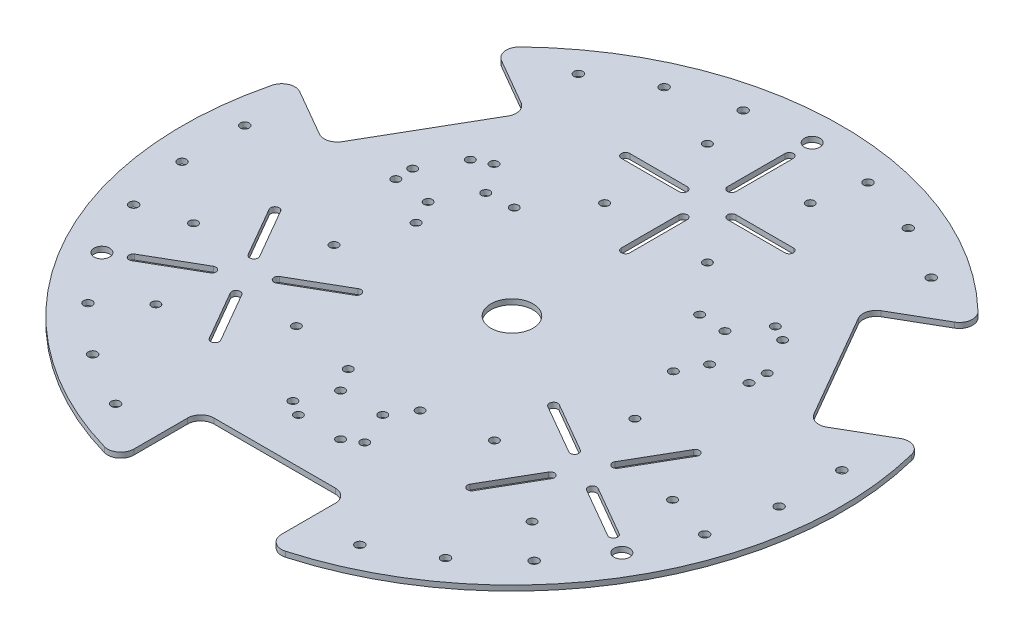
from build123d import *

# Parameters (mm, degrees)
SKETCH1_R           = 8
SKETCH1_R_2         = 2.95
SKETCH1_R_3         = 1.675
SKETCH1_R_4         = 1.6
BOSS_EXTRUDE2_DEPTH = 2
FILLET1_R           = 5


with BuildPart() as part:
    # Sketch1 → Boss-Extrude2 (new body)
    with BuildSketch(Plane(origin=(0, 0, 0), x_dir=(1, 0, 0), z_dir=(0, 1, 0))):
        with BuildLine():
            Line((-89.442286341, 25.081415713), (-66.442286341, 64.918584287))
            ThreePointArc((-66.442286341, 64.918584287), (-65.942784228, 68.712679513), (-68.27241336, 71.748711306))
            Line((-68.27241336, 71.748711306), (-91.502369642, 85.160532819))
            ThreePointArc((-91.502369642, 85.160532819), (0, 125), (91.502369642, 85.160532819))
            Line((91.502369642, 85.160532819), (68.27241336, 71.748711306))
            ThreePointArc((68.27241336, 71.748711306), (65.942784228, 68.712679513), (66.442286341, 64.918584287))
            Line((66.442286341, 64.918584287), (89.442286341, 25.081415713))
            ThreePointArc((89.442286341, 25.081415713), (92.478318134, 22.751786582), (96.27241336, 23.251288694))
            Line((96.27241336, 23.251288694), (119.502369642, 36.663110207))
            ThreePointArc((119.502369642, 36.663110207), (108.253175473, -62.5), (28, -121.823643025))
            Line((28, -121.823643025), (28, -95))
            ThreePointArc((28, -95), (26.535533906, -91.464466094), (23, -90))
            Line((23, -90), (-23, -90))
            ThreePointArc((-23, -90), (-26.535533906, -91.464466094), (-28, -95))
            Line((-28, -95), (-28, -121.823643025))
            ThreePointArc((-28, -121.823643025), (-108.253175473, -62.5), (-119.502369642, 36.663110207))
            Line((-119.502369642, 36.663110207), (-96.27241336, 23.251288694))
            ThreePointArc((-96.27241336, 23.251288694), (-92.478318134, 22.751786582), (-89.442286341, 25.081415713))
        make_face()
        with Locations(Location((0, 0, 0), (0, 0, 270))):
            Circle(SKETCH1_R, mode=Mode.SUBTRACT)
        with Locations(Location((0, 113.85, 0), (0, 0, 270))):
            Circle(SKETCH1_R_2, mode=Mode.SUBTRACT)
        with Locations(Location((98.596992221, -56.925, 0), (0, 0, 270))):
            Circle(SKETCH1_R_2, mode=Mode.SUBTRACT)
        with Locations(Location((-98.596992221, -56.925, 0), (0, 0, 270))):
            Circle(SKETCH1_R_2, mode=Mode.SUBTRACT)
        with Locations(Location((23.670746, 111.362104344, 0), (0, 0, 270))):
            Circle(SKETCH1_R_3, mode=Mode.SUBTRACT)
        with Locations(Location((46.306966814, 104.007150353, 0), (0, 0, 270))):
            Circle(SKETCH1_R_3, mode=Mode.SUBTRACT)
        with Locations(Location((66.919350973, 92.10658481, 0), (0, 0, 270))):
            Circle(SKETCH1_R_3, mode=Mode.SUBTRACT)
        with Locations(Location((113.226317788, 11.900565543, 0), (0, 0, 270))):
            Circle(SKETCH1_R_3, mode=Mode.SUBTRACT)
        with Locations(Location((113.226317788, -11.900565543, 0), (0, 0, 270))):
            Circle(SKETCH1_R_3, mode=Mode.SUBTRACT)
        with Locations(Location((108.27778438, -35.18158481, 0), (0, 0, 270))):
            Circle(SKETCH1_R_3, mode=Mode.SUBTRACT)
        with Locations(Location((84.607038381, -76.180519534, 0), (0, 0, 270))):
            Circle(SKETCH1_R_3, mode=Mode.SUBTRACT)
        with Locations(Location((66.919350974, -92.10658481, 0), (0, 0, 270))):
            Circle(SKETCH1_R_3, mode=Mode.SUBTRACT)
        with Locations(Location((46.306966814, -104.007150353, 0), (0, 0, 270))):
            Circle(SKETCH1_R_3, mode=Mode.SUBTRACT)
        with Locations(Location((-46.306966814, -104.007150353, 0), (0, 0, 270))):
            Circle(SKETCH1_R_3, mode=Mode.SUBTRACT)
        with Locations(Location((-66.919350973, -92.10658481, 0), (0, 0, 270))):
            Circle(SKETCH1_R_3, mode=Mode.SUBTRACT)
        with Locations(Location((-84.607038381, -76.180519534, 0), (0, 0, 270))):
            Circle(SKETCH1_R_3, mode=Mode.SUBTRACT)
        with Locations(Location((-108.27778438, -35.18158481, 0), (0, 0, 270))):
            Circle(SKETCH1_R_3, mode=Mode.SUBTRACT)
        with Locations(Location((-113.226317788, -11.900565543, 0), (0, 0, 270))):
            Circle(SKETCH1_R_3, mode=Mode.SUBTRACT)
        with Locations(Location((-113.226317788, 11.900565543, 0), (0, 0, 270))):
            Circle(SKETCH1_R_3, mode=Mode.SUBTRACT)
        with Locations(Location((-66.919350973, 92.10658481, 0), (0, 0, 270))):
            Circle(SKETCH1_R_3, mode=Mode.SUBTRACT)
        with Locations(Location((-46.306966814, 104.007150353, 0), (0, 0, 270))):
            Circle(SKETCH1_R_3, mode=Mode.SUBTRACT)
        with Locations(Location((-23.670746, 111.362104344, 0), (0, 0, 270))):
            Circle(SKETCH1_R_3, mode=Mode.SUBTRACT)
        with Locations(Location((-90.831628429, -29.925004626, 0), (0, 0, 270))):
            Circle(SKETCH1_R_4, mode=Mode.SUBTRACT)
        with Locations(Location((-57.056637682, -10.425004626, 0), (0, 0, 270))):
            Circle(SKETCH1_R_4, mode=Mode.SUBTRACT)
        with Locations(Location((-37.556637682, -44.199995374, 0), (0, 0, 270))):
            Circle(SKETCH1_R_4, mode=Mode.SUBTRACT)
        with Locations(Location((-71.331628429, -63.699995374, 0), (0, 0, 270))):
            Circle(SKETCH1_R_4, mode=Mode.SUBTRACT)
        with Locations(Location((19.5, 93.625, 0), (0, 0, 270))):
            Circle(SKETCH1_R_4, mode=Mode.SUBTRACT)
        with Locations(Location((19.5, 54.625, 0), (0, 0, 270))):
            Circle(SKETCH1_R_4, mode=Mode.SUBTRACT)
        with Locations(Location((-19.5, 54.625, 0), (0, 0, 270))):
            Circle(SKETCH1_R_4, mode=Mode.SUBTRACT)
        with Locations(Location((-19.5, 93.625, 0), (0, 0, 270))):
            Circle(SKETCH1_R_4, mode=Mode.SUBTRACT)
        with Locations(Location((71.331628429, -63.699995374, 0), (0, 0, 270))):
            Circle(SKETCH1_R_4, mode=Mode.SUBTRACT)
        with Locations(Location((37.556637682, -44.199995374, 0), (0, 0, 270))):
            Circle(SKETCH1_R_4, mode=Mode.SUBTRACT)
        with Locations(Location((57.056637682, -10.425004626, 0), (0, 0, 270))):
            Circle(SKETCH1_R_4, mode=Mode.SUBTRACT)
        with Locations(Location((90.831628429, -29.925004626, 0), (0, 0, 270))):
            Circle(SKETCH1_R_4, mode=Mode.SUBTRACT)
        with Locations(Location((-13.625, -48.465, 0), (0, 0, 270))):
            Circle(SKETCH1_R_4, mode=Mode.SUBTRACT)
        with Locations(Location((13.625, -48.465, 0), (0, 0, 270))):
            Circle(SKETCH1_R_4, mode=Mode.SUBTRACT)
        with Locations(Location((13.625, -69.465, 0), (0, 0, 270))):
            Circle(SKETCH1_R_4, mode=Mode.SUBTRACT)
        with Locations(Location((-13.625, -69.465, 0), (0, 0, 270))):
            Circle(SKETCH1_R_4, mode=Mode.SUBTRACT)
        with Locations(Location((-35.159421194, 36.032096127, 0), (0, 0, 270))):
            Circle(SKETCH1_R_4, mode=Mode.SUBTRACT)
        with Locations(Location((-48.784421194, 12.432903873, 0), (0, 0, 270))):
            Circle(SKETCH1_R_4, mode=Mode.SUBTRACT)
        with Locations(Location((-66.970954674, 22.932903873, 0), (0, 0, 270))):
            Circle(SKETCH1_R_4, mode=Mode.SUBTRACT)
        with Locations(Location((-53.345954674, 46.532096127, 0), (0, 0, 270))):
            Circle(SKETCH1_R_4, mode=Mode.SUBTRACT)
        with Locations(Location((48.784421194, 12.432903873, 0), (0, 0, 270))):
            Circle(SKETCH1_R_4, mode=Mode.SUBTRACT)
        with Locations(Location((35.159421194, 36.032096127, 0), (0, 0, 270))):
            Circle(SKETCH1_R_4, mode=Mode.SUBTRACT)
        with Locations(Location((53.345954674, 46.532096127, 0), (0, 0, 270))):
            Circle(SKETCH1_R_4, mode=Mode.SUBTRACT)
        with Locations(Location((66.970954674, 22.932903873, 0), (0, 0, 270))):
            Circle(SKETCH1_R_4, mode=Mode.SUBTRACT)
        with Locations(Location((-8, -73, 0), (0, 0, 270))):
            Circle(SKETCH1_R_4, mode=Mode.SUBTRACT)
        with Locations(Location((-8, -57, 0), (0, 0, 270))):
            Circle(SKETCH1_R_4, mode=Mode.SUBTRACT)
        with Locations(Location((8, -57, 0), (0, 0, 270))):
            Circle(SKETCH1_R_4, mode=Mode.SUBTRACT)
        with Locations(Location((8, -73, 0), (0, 0, 270))):
            Circle(SKETCH1_R_4, mode=Mode.SUBTRACT)
        with Locations(Location((-59.219854476, 43.42820323, 0), (0, 0, 270))):
            Circle(SKETCH1_R_4, mode=Mode.SUBTRACT)
        with Locations(Location((-45.363448016, 35.42820323, 0), (0, 0, 270))):
            Circle(SKETCH1_R_4, mode=Mode.SUBTRACT)
        with Locations(Location((-53.363448016, 21.57179677, 0), (0, 0, 270))):
            Circle(SKETCH1_R_4, mode=Mode.SUBTRACT)
        with Locations(Location((-67.219854476, 29.57179677, 0), (0, 0, 270))):
            Circle(SKETCH1_R_4, mode=Mode.SUBTRACT)
        with Locations(Location((67.219854476, 29.57179677, 0), (0, 0, 270))):
            Circle(SKETCH1_R_4, mode=Mode.SUBTRACT)
        with Locations(Location((53.363448016, 21.57179677, 0), (0, 0, 270))):
            Circle(SKETCH1_R_4, mode=Mode.SUBTRACT)
        with Locations(Location((45.363448016, 35.42820323, 0), (0, 0, 270))):
            Circle(SKETCH1_R_4, mode=Mode.SUBTRACT)
        with Locations(Location((59.219854476, 43.42820323, 0), (0, 0, 270))):
            Circle(SKETCH1_R_4, mode=Mode.SUBTRACT)
        with BuildLine():
            Line((-71.383217405, -43.060640646), (-90.262571208, -53.960640646))
            ThreePointArc((-90.262571208, -53.960640646), (-92.448211854, -53.375), (-91.862571208, -51.189359354))
            Line((-91.862571208, -51.189359354), (-72.983217405, -40.289359354))
            ThreePointArc((-72.983217405, -40.289359354), (-70.797576759, -40.875), (-71.383217405, -43.060640646))
        make_face(mode=Mode.SUBTRACT)
        with BuildLine():
            Line((-70.192273702, -29.87341565), (-81.092273702, -10.994061848))
            ThreePointArc((-81.092273702, -10.994061848), (-80.506633056, -8.808421202), (-78.320992409, -9.394061848))
            Line((-78.320992409, -9.394061848), (-67.420992409, -28.27341565))
            ThreePointArc((-67.420992409, -28.27341565), (-68.006633056, -30.459056296), (-70.192273702, -29.87341565))
        make_face(mode=Mode.SUBTRACT)
        with BuildLine():
            Line((-57.005048706, -31.064359354), (-38.125694903, -20.164359354))
            ThreePointArc((-38.125694903, -20.164359354), (-35.940054257, -20.75), (-36.525694903, -22.935640646))
            Line((-36.525694903, -22.935640646), (-55.405048706, -33.835640646))
            ThreePointArc((-55.405048706, -33.835640646), (-57.590689352, -33.25), (-57.005048706, -31.064359354))
        make_face(mode=Mode.SUBTRACT)
        with BuildLine():
            Line((-58.195992409, -44.25158435), (-47.295992409, -63.130938152))
            ThreePointArc((-47.295992409, -63.130938152), (-47.881633056, -65.316578798), (-50.067273702, -64.730938152))
            Line((-50.067273702, -64.730938152), (-60.967273702, -45.85158435))
            ThreePointArc((-60.967273702, -45.85158435), (-60.381633056, -43.665943704), (-58.195992409, -44.25158435))
        make_face(mode=Mode.SUBTRACT)
        with BuildLine():
            Line((-1.6, 83.35), (-1.6, 105.15))
            ThreePointArc((-1.6, 105.15), (0, 106.75), (1.6, 105.15))
            Line((1.6, 105.15), (1.6, 83.35))
            ThreePointArc((1.6, 83.35), (0, 81.75), (-1.6, 83.35))
        make_face(mode=Mode.SUBTRACT)
        with BuildLine():
            Line((-1.6, 43.1), (-1.6, 64.9))
            ThreePointArc((-1.6, 64.9), (0, 66.5), (1.6, 64.9))
            Line((1.6, 64.9), (1.6, 43.1))
            ThreePointArc((1.6, 43.1), (0, 41.5), (-1.6, 43.1))
        make_face(mode=Mode.SUBTRACT)
        with BuildLine():
            Line((9.225, 75.725), (31.025, 75.725))
            ThreePointArc((31.025, 75.725), (32.625, 74.125), (31.025, 72.525))
            Line((31.025, 72.525), (9.225, 72.525))
            ThreePointArc((9.225, 72.525), (7.625, 74.125), (9.225, 75.725))
        make_face(mode=Mode.SUBTRACT)
        with BuildLine():
            Line((-9.225, 72.525), (-31.025, 72.525))
            ThreePointArc((-31.025, 72.525), (-32.625, 74.125), (-31.025, 75.725))
            Line((-31.025, 75.725), (-9.225, 75.725))
            ThreePointArc((-9.225, 75.725), (-7.625, 74.125), (-9.225, 72.525))
        make_face(mode=Mode.SUBTRACT)
        with BuildLine():
            Line((72.983217405, -40.289359354), (91.862571208, -51.189359354))
            ThreePointArc((91.862571208, -51.189359354), (92.448211854, -53.375), (90.262571208, -53.960640646))
            Line((90.262571208, -53.960640646), (71.383217405, -43.060640646))
            ThreePointArc((71.383217405, -43.060640646), (70.797576759, -40.875), (72.983217405, -40.289359354))
        make_face(mode=Mode.SUBTRACT)
        with BuildLine():
            Line((38.125694903, -20.164359354), (57.005048706, -31.064359354))
            ThreePointArc((57.005048706, -31.064359354), (57.590689352, -33.25), (55.405048706, -33.835640646))
            Line((55.405048706, -33.835640646), (36.525694903, -22.935640646))
            ThreePointArc((36.525694903, -22.935640646), (35.940054257, -20.75), (38.125694903, -20.164359354))
        make_face(mode=Mode.SUBTRACT)
        with BuildLine():
            Line((60.967273702, -45.85158435), (50.067273702, -64.730938152))
            ThreePointArc((50.067273702, -64.730938152), (47.881633056, -65.316578798), (47.295992409, -63.130938152))
            Line((47.295992409, -63.130938152), (58.195992409, -44.25158435))
            ThreePointArc((58.195992409, -44.25158435), (60.381633056, -43.665943704), (60.967273702, -45.85158435))
        make_face(mode=Mode.SUBTRACT)
        with BuildLine():
            Line((67.420992409, -28.27341565), (78.320992409, -9.394061848))
            ThreePointArc((78.320992409, -9.394061848), (80.506633056, -8.808421202), (81.092273702, -10.994061848))
            Line((81.092273702, -10.994061848), (70.192273702, -29.87341565))
            ThreePointArc((70.192273702, -29.87341565), (68.006633056, -30.459056296), (67.420992409, -28.27341565))
        make_face(mode=Mode.SUBTRACT)
    extrude(amount=BOSS_EXTRUDE2_DEPTH)

    # Fillet1
    fillet1_edges = [part.edges().sort_by_distance(p)[0] for p in [
        (-28, 1, 121.823643025),
        (-119.502369642, 1, -36.663110207),
        (-91.502369642, 1, -85.160532819),
        (91.502369642, 1, -85.160532819),
        (119.502369642, 1, -36.663110207),
        (28, 1, 121.823643025),
    ]]
    fillet(fillet1_edges, radius=FILLET1_R)


solid = part.part
